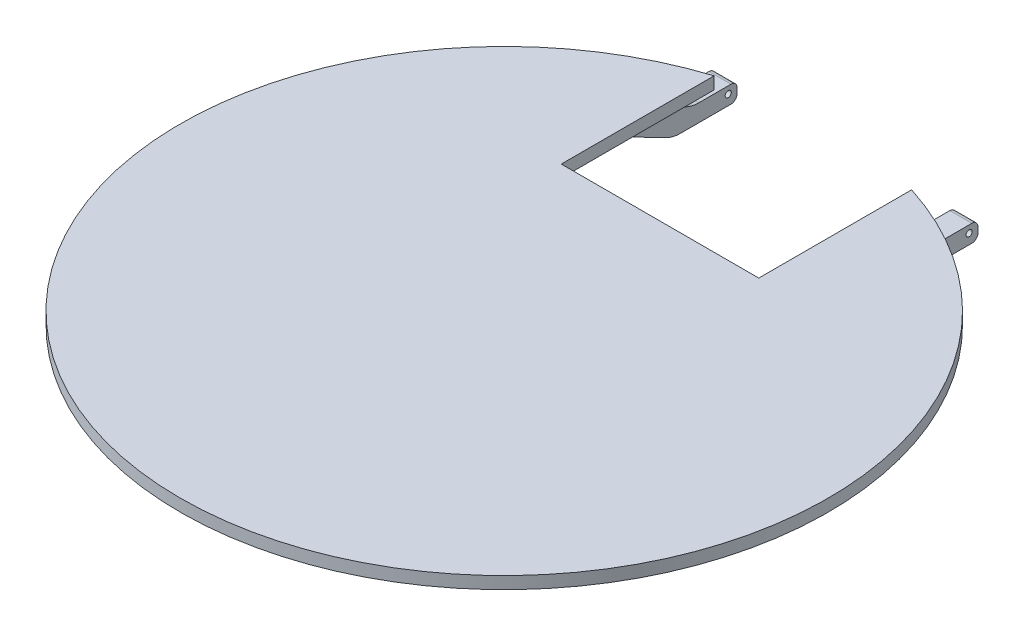
from build123d import *

# Parameters (mm, degrees)
ESTRUSIONE_ESTRUSIONE1_DEPTH = 4
SCHIZZO3_R                   = 1
ESTRUSIONE_ESTRUSIONE2_DEPTH = 7.2
RIPETIZIONE_A_L1_COUNT       = 2
RIPETIZIONE_A_L1_PITCH       = 78.8
TAGLIO_ESTRUSIONE1_DEPTH     = 0.0001


with BuildPart() as part:
    # Schizzo1 → Estrusione-Estrusione1 (new body)
    with BuildSketch(Plane(origin=(0, 0, 0), x_dir=(1, 0, 0), z_dir=(0, 1, 0))):
        with BuildLine():
            Line((0, 50.958952055), (0, -106))
            ThreePointArc((0, -106), (104.732155802, -16.345505226), (32.3, 100.958952055))
            Line((32.3, 100.958952055), (32.3, 50.958952055))
            Line((32.3, 50.958952055), (0, 50.958952055))
        make_face()
        with BuildLine():
            ThreePointArc((-32.3, 100.958952055), (-104.732155802, -16.345505226), (0, -106))
            Line((0, -106), (0, 50.958952055))
            Line((0, 50.958952055), (-32.3, 50.958952055))
            Line((-32.3, 50.958952055), (-32.3, 100.958952055))
        make_face()
    extrude(amount=ESTRUSIONE_ESTRUSIONE1_DEPTH)

    # Schizzo4 → Taglio-Estrusione1 (cut)
    with BuildSketch(Plane.XZ):
        with BuildLine():
            Line((68, -41), (68, 74))
            Line((68, 74), (-75.894663844, 74))
            ThreePointArc((-75.894663844, 74), (-104.136158772, 19.790412733), (-97.749680306, -41))
            Line((-97.749680306, -41), (68, -41))
        make_face()
    extrude(amount=-TAGLIO_ESTRUSIONE1_DEPTH, mode=Mode.SUBTRACT)


with BuildPart() as body_2:
    # Schizzo3 → Estrusione-Estrusione2 (new body)
    with BuildSketch(Plane.ZY.offset(-35.8)):
        with BuildLine():
            Line((-70.958952055, 0), (-90.958952055, 0))
            Line((-90.958952055, 0), (-91.637551092, -0.854213861))
            ThreePointArc((-91.637551092, -0.854213861), (-95.120257392, -3.639592846), (-99.467531221, -4.633971809))
            Line((-99.467531221, -4.633971809), (-109.968629526, -4.633971809))
            ThreePointArc((-109.968629526, -4.633971809), (-111.382843089, -5.219758246), (-111.968629526, -6.633971809))
            Line((-111.968629526, -6.633971809), (-111.968629526, -8.301701811))
            ThreePointArc((-111.968629526, -8.301701811), (-111.382843089, -9.715915373), (-109.968629526, -10.301701811))
            Line((-109.968629526, -10.301701811), (-93.383040263, -10.301701811))
            ThreePointArc((-93.383040263, -10.301701811), (-91.027181563, -10.020237183), (-88.803941042, -9.191687768))
            Line((-88.803941042, -9.191687768), (-70.958952055, 0))
        make_face()
        with Locations((-109.068952055, -7)):
            Circle(SCHIZZO3_R, mode=Mode.SUBTRACT)
    extrude(amount=-ESTRUSIONE_ESTRUSIONE2_DEPTH)


with BuildPart() as ripetizione_a_l1_1:
    # Ripetizione a L1: pattern copy
    add(body_2.part.moved(Location(Vector(-1, 0, 0) * (1 * RIPETIZIONE_A_L1_PITCH))))


solid = Compound([part.part, body_2.part, ripetizione_a_l1_1.part])
